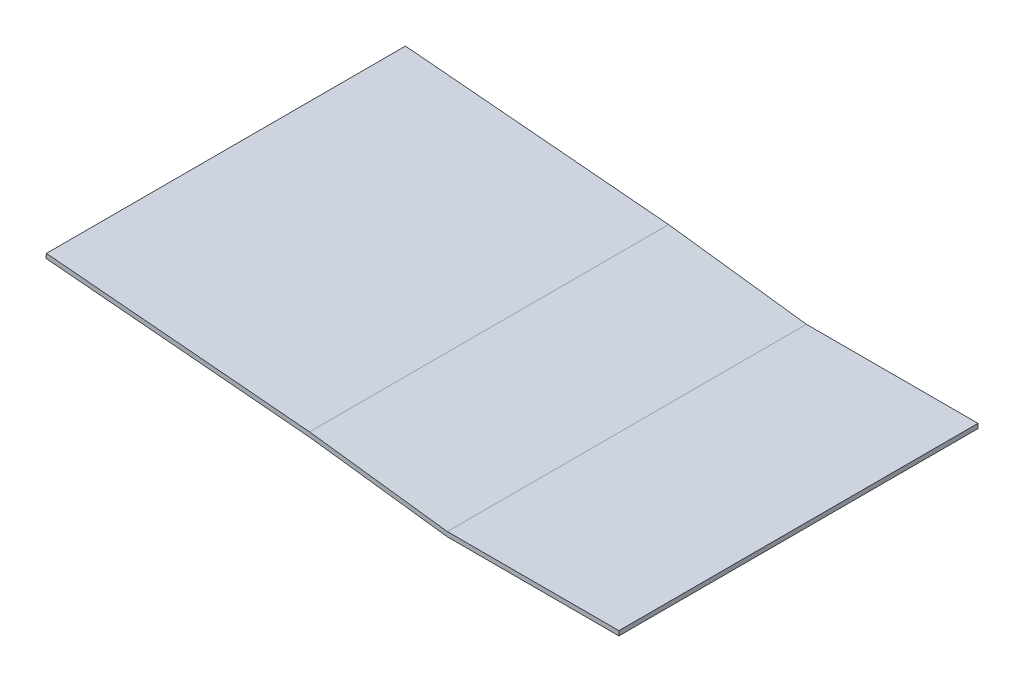
from build123d import *

# Parameters (mm, degrees)
SKETCH1_W           = 119.46432313
SKETCH1_H           = 3.175
BOSS_EXTRUDE1_DEPTH = 250


with BuildPart() as part:
    # Sketch1 → Boss-Extrude1 (new body)
    with BuildSketch(Plane.XY):
        Polygon((-4531.808395064, -128.147603784), (-4348.106631906, -144.21942553), (-4252.390993124, -156.337240533), (-4252.390993124, -153.162240533), (-4348.324803087, -141.01321004), (-4531.531675581, -124.984685617), align=None)
        with Locations((-4192.658831559, -154.749740533)):
            Rectangle(SKETCH1_W, SKETCH1_H)
    extrude(amount=-BOSS_EXTRUDE1_DEPTH)


solid = part.part
